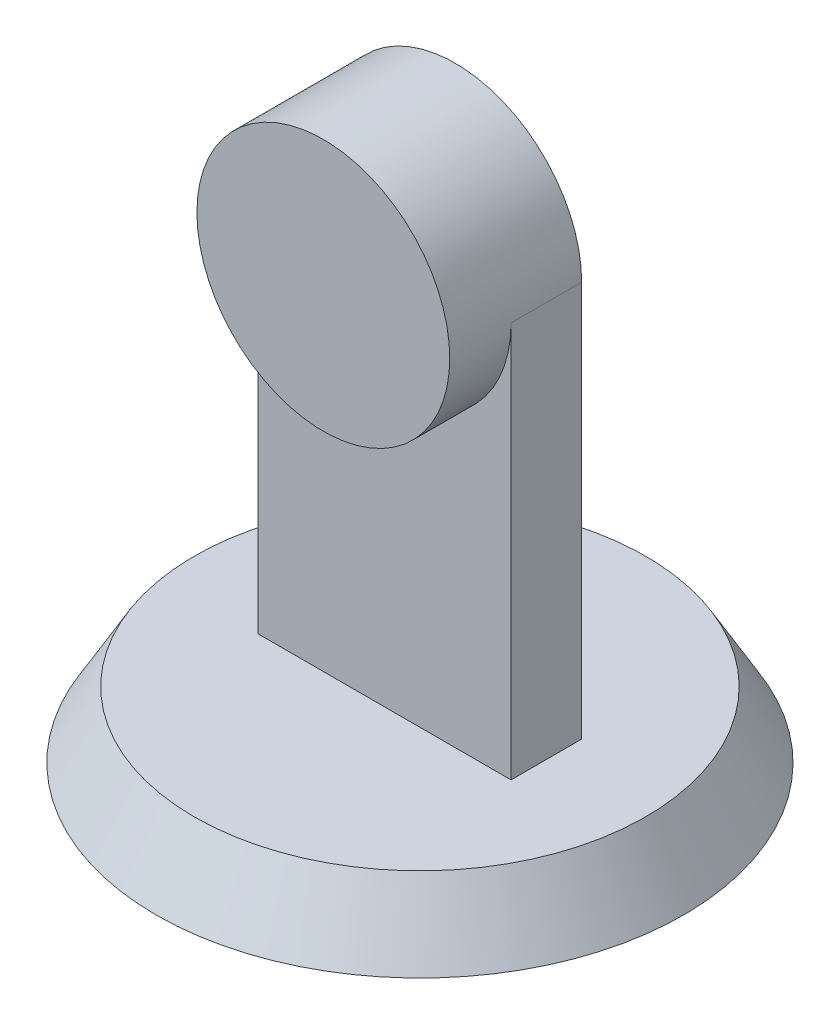
from build123d import *

# Parameters (mm, degrees)
SKETCH1_R           = 40
BOSS_EXTRUDE1_DEPTH = 10
BOSS_EXTRUDE1_TAPER = 30
SKETCH2_W           = 38.335841008
SKETCH2_H           = 10.708335478
BOSS_EXTRUDE2_DEPTH = 60
SKETCH3_R           = 19.167920504
BOSS_EXTRUDE3_DEPTH = 20


with BuildPart() as part:
    # Sketch1 → Boss-Extrude1 (new body)
    with BuildSketch(Plane(origin=(0, 0, 0), x_dir=(1, 0, 0), z_dir=(0, 1, 0))):
        Circle(SKETCH1_R)
    extrude(amount=BOSS_EXTRUDE1_DEPTH, taper=BOSS_EXTRUDE1_TAPER)

    # Sketch2 → Boss-Extrude2 (add)
    with BuildSketch(Plane(origin=(0, 10, 0), x_dir=(1, 0, 0), z_dir=(0, 1, 0))):
        Rectangle(SKETCH2_W, SKETCH2_H)
    extrude(amount=BOSS_EXTRUDE2_DEPTH)

    # Sketch3 → Boss-Extrude3 (add)
    with BuildSketch(Plane(origin=(0, 0, -5.354167739), x_dir=(-1, 0, 0), z_dir=(0, 0, -1))):
        with Locations((0, 70)):
            Circle(SKETCH3_R)
    extrude(amount=-BOSS_EXTRUDE3_DEPTH)


solid = part.part
